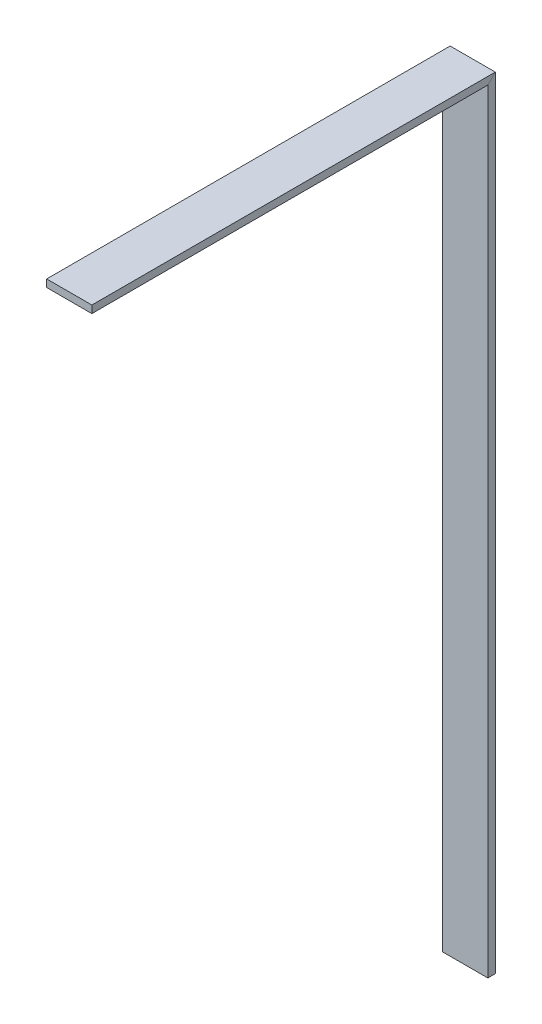
from build123d import *

# Parameters (mm, degrees)
CROQUIS1_W              = 38.1
CROQUIS1_H              = 850.5
SALIENTE_EXTRUIR1_DEPTH = 6.31
CROQUIS2_W              = 38.1
CROQUIS2_H              = 6.31
SALIENTE_EXTRUIR2_DEPTH = 70
CROQUIS3_W              = 38.1
CROQUIS3_H              = 6.31
SALIENTE_EXTRUIR3_DEPTH = 578
CROQUIS4_R              = 6.935856655
CORTAR_EXTRUIR1_DEPTH   = 7
CROQUIS5_W              = 38.1
CROQUIS5_H              = 687.72607772
CORTAR_EXTRUIR2_DEPTH   = 10
CROQUIS6_W              = 38.1
CROQUIS6_H              = 6.31
CROQUIS8_W              = 368.89
CROQUIS8_H              = 6.31
CORTAR_EXTRUIR3_DEPTH   = 147


with BuildPart() as part:
    # Croquis1 → Saliente-Extruir1 (new body)
    with BuildSketch(Plane.XY):
        Rectangle(CROQUIS1_W, CROQUIS1_H)
    extrude(amount=SALIENTE_EXTRUIR1_DEPTH)

    # Croquis2 → Saliente-Extruir2 (add)
    with BuildSketch(Plane.XY.offset(6.31)):
        with Locations((0, -422.095)):
            Rectangle(CROQUIS2_W, CROQUIS2_H)
    extrude(amount=SALIENTE_EXTRUIR2_DEPTH)

    # Croquis3 → Saliente-Extruir3 (add)
    with BuildSketch(Plane.XY.offset(6.31)):
        with Locations((0, -265.63107772)):
            Rectangle(CROQUIS3_W, CROQUIS3_H)
    extrude(amount=-SALIENTE_EXTRUIR3_DEPTH)

    # Croquis4 → Cortar-Extruir1 (cut)
    with BuildSketch(Plane(origin=(0, -262.47607772, 0), x_dir=(1, 0, 0), z_dir=(0, 1, 0))):
        with Locations(Location((0, 536.981534281, 0), (0, 0, 270))):
            Circle(CROQUIS4_R)
    extrude(amount=-CORTAR_EXTRUIR1_DEPTH, mode=Mode.SUBTRACT)

    # Croquis5 → Cortar-Extruir2 (cut)
    with BuildSketch(Plane(origin=(0, 0, 0), x_dir=(-1, 0, 0), z_dir=(0, 0, -1))):
        with Locations((0, 81.38696114)):
            Rectangle(CROQUIS5_W, CROQUIS5_H)
    extrude(amount=-CORTAR_EXTRUIR2_DEPTH, mode=Mode.SUBTRACT)

    # Barrer1: sweep along a curve in space
    with BuildLine() as barrer1_path:
        Line((0, -262.47607772, -199.645), (0, 386.85392228, -199.645))
        Line((0, 386.85392228, -199.645), (0, 386.85392228, 137.595))
    # Croquis6 → Barrer1 (sweep)
    with BuildSketch(Plane(origin=(0, -262.47607772, 0), x_dir=(1, 0, 0), z_dir=(0, 1, 0))):
        with Locations((0, 199.645)):
            Rectangle(CROQUIS6_W, CROQUIS6_H)
    sweep(path=barrer1_path.line, transition=Transition.RIGHT)

    # Croquis8 → Cortar-Extruir3 (cut)
    with BuildSketch(Plane(origin=(19.05, 0, 0), x_dir=(0, 0, -1), z_dir=(1, 0, 0))):
        Polygon((196.49, -262.47607772), (196.49, -268.78607772), (196.49, -444.307673596), (-90.834600665, -444.307673596), (-90.834600665, -262.47607772), align=None)
        with Locations((387.245, -265.63107772)):
            Rectangle(CROQUIS8_W, CROQUIS8_H)
    extrude(amount=-CORTAR_EXTRUIR3_DEPTH, mode=Mode.SUBTRACT)


solid = part.part
